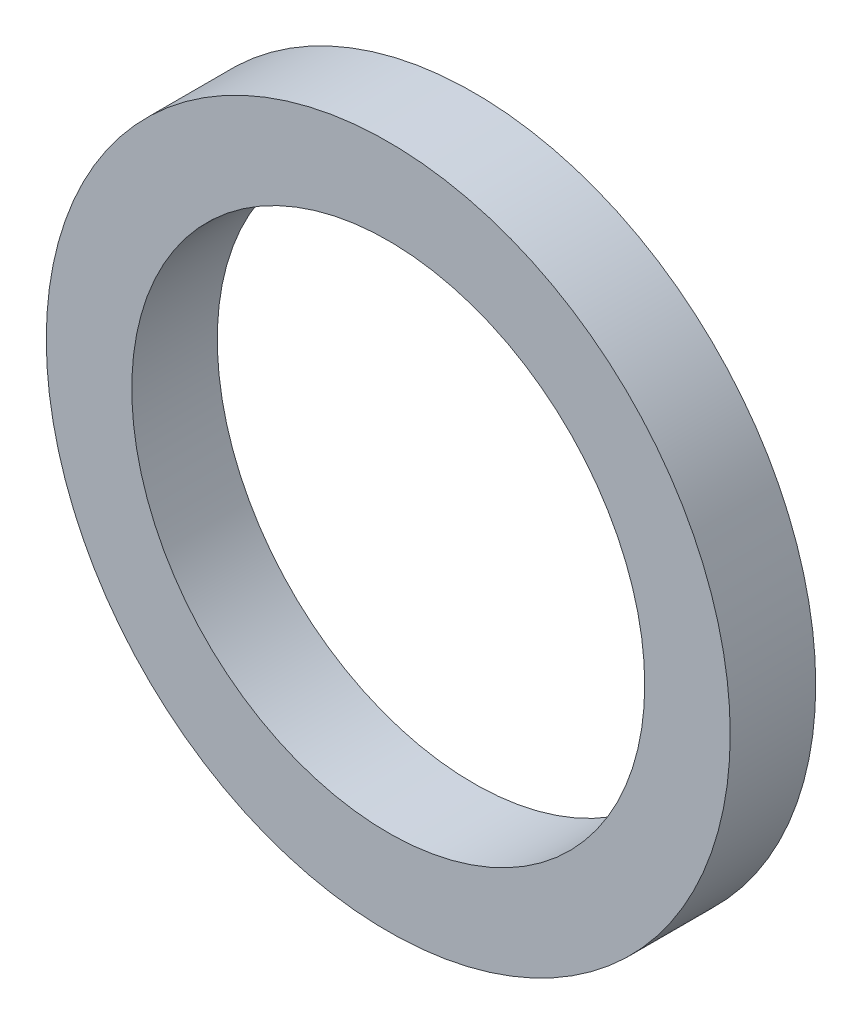
from build123d import *

# Parameters (mm, degrees)
ESQUISSE1_R      = 2
ESQUISSE1_R_2    = 1.5
EXTRUSION1_DEPTH = 0.25


with BuildPart() as part:
    # Esquisse1 → Extrusion1 (new, symmetric)
    with BuildSketch(Plane.XY):
        Circle(ESQUISSE1_R)
        Circle(ESQUISSE1_R_2, mode=Mode.SUBTRACT)
    extrude(amount=EXTRUSION1_DEPTH, both=True)


solid = part.part
